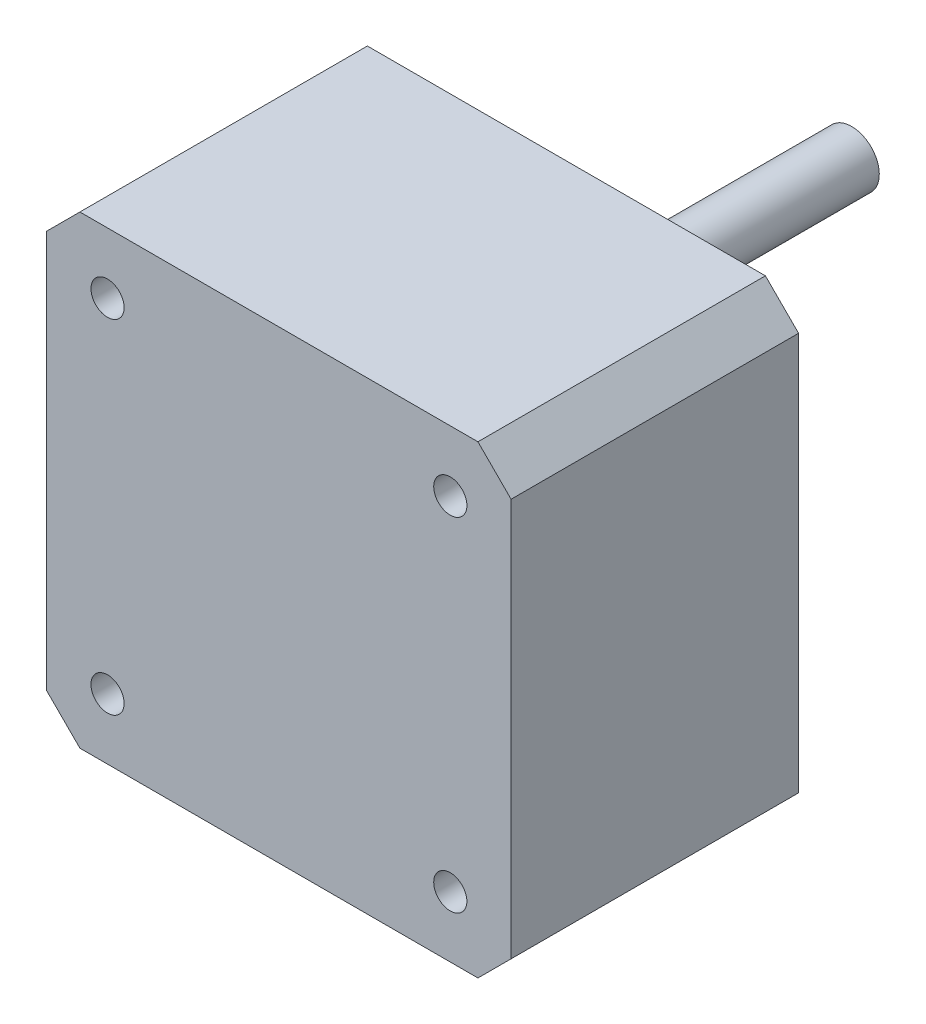
from build123d import *

# Parameters (mm, degrees)
SKETCH1_W           = 42
SKETCH1_H           = 42
BOSS_EXTRUDE1_DEPTH = 26
CHAMFER1_SIZE       = 3
SKETCH4_R           = 11.25
BOSS_EXTRUDE2_DEPTH = 0.5
CUT_EXTRUDE4_REACH  = 41.472
SKETCH8_R           = 1.5
SKETCH9_R           = 18.35
CUT_EXTRUDE5_DEPTH  = 0.5
SKETCH10_R          = 8.9
SKETCH10_R_2        = 2.75
BOSS_EXTRUDE3_DEPTH = 3.5
BOSS_EXTRUDE4_DEPTH = 26.3
FILLET1_R           = 0.5


with BuildPart() as part:
    # Sketch1 → Boss-Extrude1 (new body)
    with BuildSketch(Plane.XY):
        Rectangle(SKETCH1_W, SKETCH1_H)
    extrude(amount=BOSS_EXTRUDE1_DEPTH)

    # Chamfer1
    chamfer1_edges = [part.edges().sort_by_distance(p)[0] for p in [
        (-21, 21, 13),
        (21, 21, 13),
        (21, -21, 13),
        (-21, -21, 13),
    ]]
    chamfer(chamfer1_edges, length=CHAMFER1_SIZE)

    # Sketch4 → Boss-Extrude2 (add)
    with BuildSketch(Plane(origin=(0, 0, 0), x_dir=(-1, 0, 0), z_dir=(0, 0, -1))):
        Circle(SKETCH4_R)
    extrude(amount=-BOSS_EXTRUDE2_DEPTH)

    # Sketch8 → Cut-Extrude4 (cut, up to next)
    with BuildSketch(Plane(origin=(0, 0, 0), x_dir=(-1, 0, 0), z_dir=(0, 0, -1)), mode=Mode.PRIVATE) as cut_extrude4_sk1:
        with Locations((15.5, 15.5)):
            Circle(SKETCH8_R)
    cut_extrude4_tool1 = extrude(cut_extrude4_sk1.sketch, amount=-CUT_EXTRUDE4_REACH, mode=Mode.PRIVATE) & part.part
    # Sketch8 → Cut-Extrude4 (cut, up to next)
    with BuildSketch(Plane(origin=(0, 0, 0), x_dir=(-1, 0, 0), z_dir=(0, 0, -1)), mode=Mode.PRIVATE) as cut_extrude4_sk2:
        with Locations((-15.5, 15.5)):
            Circle(SKETCH8_R)
    cut_extrude4_tool2 = extrude(cut_extrude4_sk2.sketch, amount=-CUT_EXTRUDE4_REACH, mode=Mode.PRIVATE) & part.part
    # Sketch8 → Cut-Extrude4 (cut, up to next)
    with BuildSketch(Plane(origin=(0, 0, 0), x_dir=(-1, 0, 0), z_dir=(0, 0, -1)), mode=Mode.PRIVATE) as cut_extrude4_sk3:
        with Locations((-15.5, -15.5)):
            Circle(SKETCH8_R)
    cut_extrude4_tool3 = extrude(cut_extrude4_sk3.sketch, amount=-CUT_EXTRUDE4_REACH, mode=Mode.PRIVATE) & part.part
    # Sketch8 → Cut-Extrude4 (cut, up to next)
    with BuildSketch(Plane(origin=(0, 0, 0), x_dir=(-1, 0, 0), z_dir=(0, 0, -1)), mode=Mode.PRIVATE) as cut_extrude4_sk4:
        with Locations((15.5, -15.5)):
            Circle(SKETCH8_R)
    cut_extrude4_tool4 = extrude(cut_extrude4_sk4.sketch, amount=-CUT_EXTRUDE4_REACH, mode=Mode.PRIVATE) & part.part
    add(cut_extrude4_tool1.solids().sort_by_distance((-15.5, 15.5, 0))[0], mode=Mode.SUBTRACT)
    add(cut_extrude4_tool2.solids().sort_by_distance((15.5, 15.5, 0))[0], mode=Mode.SUBTRACT)
    add(cut_extrude4_tool3.solids().sort_by_distance((15.5, -15.5, 0))[0], mode=Mode.SUBTRACT)
    add(cut_extrude4_tool4.solids().sort_by_distance((-15.5, -15.5, 0))[0], mode=Mode.SUBTRACT)

    # Sketch9 → Cut-Extrude5 (cut)
    with BuildSketch(Plane(origin=(0, 0, 0), x_dir=(-1, 0, 0), z_dir=(0, 0, -1))):
        Circle(SKETCH9_R)
    extrude(amount=-CUT_EXTRUDE5_DEPTH, mode=Mode.SUBTRACT)

    # Sketch10 → Boss-Extrude3 (add)
    with BuildSketch(Plane(origin=(0, 0, 0.5), x_dir=(-1, 0, 0), z_dir=(0, 0, -1))):
        with Locations((0, 8.3)):
            Circle(SKETCH10_R)
        with Locations((0, 8.3)):
            Circle(SKETCH10_R_2, mode=Mode.SUBTRACT)
    extrude(amount=BOSS_EXTRUDE3_DEPTH)

    # Sketch11 → Boss-Extrude4 (add)
    with BuildSketch(Plane(origin=(0, 0, 0.5), x_dir=(-1, 0, 0), z_dir=(0, 0, -1))):
        with BuildLine():
            Line((-1.681517172, 6.45), (1.681517172, 6.45))
            ThreePointArc((1.681517172, 6.45), (0, 10.8), (-1.681517172, 6.45))
        make_face()
    extrude(amount=BOSS_EXTRUDE4_DEPTH)

    # Fillet1
    fillet1_edges = [part.edges().sort_by_distance(p)[0] for p in [
        (8.9, 8.3, 0.5),
    ]]
    fillet(fillet1_edges, radius=FILLET1_R)


solid = part.part
